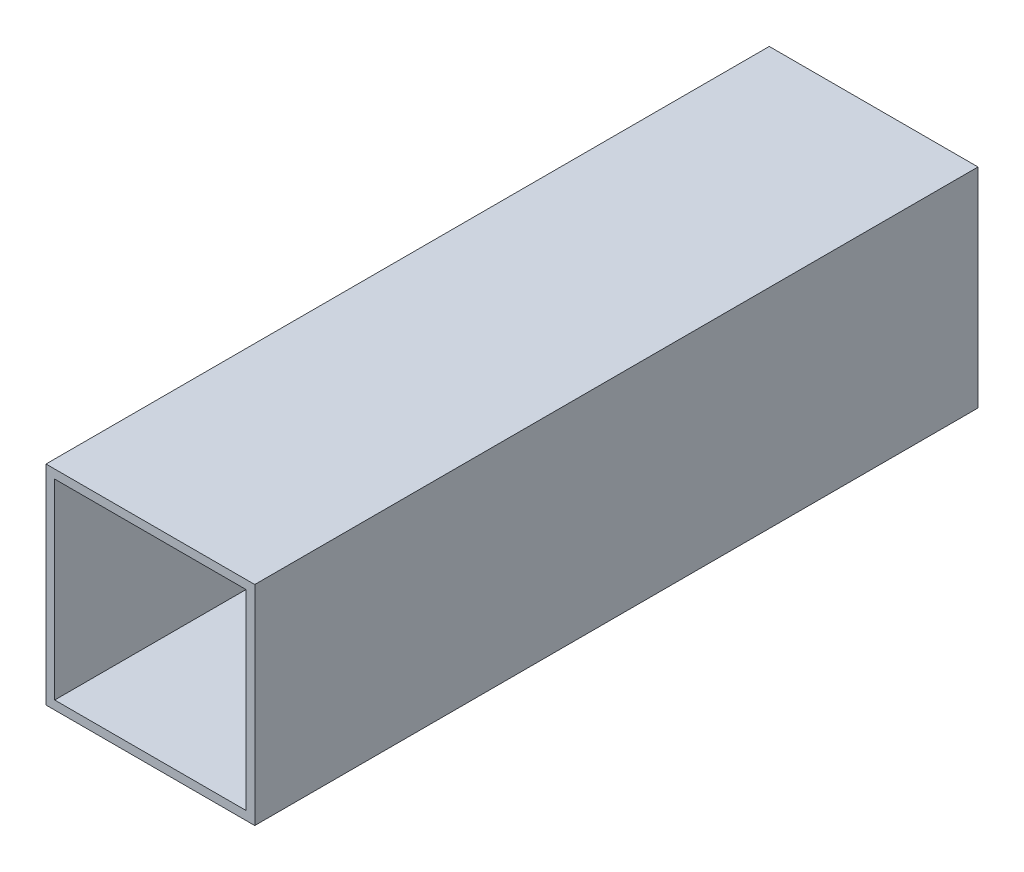
from build123d import *

# Parameters (mm, degrees)
SKETCH1_W           = 76.2
SKETCH1_H           = 76.2
SKETCH1_W_2         = 69.85
SKETCH1_H_2         = 69.85
BOSS_EXTRUDE1_DEPTH = 132


with BuildPart() as part:
    # Sketch1 → Boss-Extrude1 (new, symmetric)
    with BuildSketch(Plane.XY):
        Rectangle(SKETCH1_W, SKETCH1_H)
        Rectangle(SKETCH1_W_2, SKETCH1_H_2, mode=Mode.SUBTRACT)
    extrude(amount=BOSS_EXTRUDE1_DEPTH, both=True)


solid = part.part
